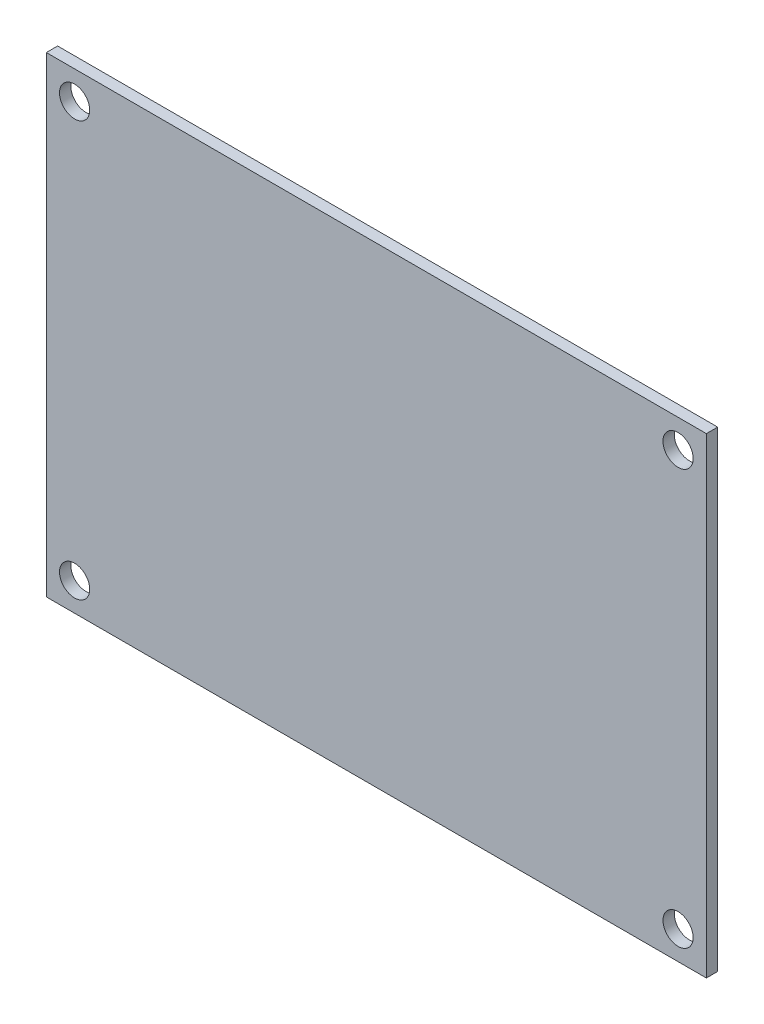
from build123d import *

# Parameters (mm, degrees)
SKETCH1_W           = 70
SKETCH1_H           = 50
BOSS_EXTRUDE1_DEPTH = 1.2
CUT_EXTRUDE1_REACH  = 45.028
SKETCH6_R           = 1.6


with BuildPart() as part:
    # Sketch1 → Boss-Extrude1 (new body)
    with BuildSketch(Plane.XY):
        Rectangle(SKETCH1_W, SKETCH1_H)
    extrude(amount=BOSS_EXTRUDE1_DEPTH)

    # Sketch6 → Cut-Extrude1 (cut, up to next)
    with BuildSketch(Plane.XY.offset(1.2), mode=Mode.PRIVATE) as cut_extrude1_sk1:
        with Locations((-32, -22)):
            Circle(SKETCH6_R)
    cut_extrude1_tool1 = extrude(cut_extrude1_sk1.sketch, amount=-CUT_EXTRUDE1_REACH, mode=Mode.PRIVATE) & part.part
    # Sketch6 → Cut-Extrude1 (cut, up to next)
    with BuildSketch(Plane.XY.offset(1.2), mode=Mode.PRIVATE) as cut_extrude1_sk2:
        with Locations(Location((32, -22, 0), (0, 0, 180))):
            Circle(SKETCH6_R)
    cut_extrude1_tool2 = extrude(cut_extrude1_sk2.sketch, amount=-CUT_EXTRUDE1_REACH, mode=Mode.PRIVATE) & part.part
    # Sketch6 → Cut-Extrude1 (cut, up to next)
    with BuildSketch(Plane.XY.offset(1.2), mode=Mode.PRIVATE) as cut_extrude1_sk3:
        with Locations((32, 22)):
            Circle(SKETCH6_R)
    cut_extrude1_tool3 = extrude(cut_extrude1_sk3.sketch, amount=-CUT_EXTRUDE1_REACH, mode=Mode.PRIVATE) & part.part
    # Sketch6 → Cut-Extrude1 (cut, up to next)
    with BuildSketch(Plane.XY.offset(1.2), mode=Mode.PRIVATE) as cut_extrude1_sk4:
        with Locations(Location((-32, 22, 0), (0, 0, 180))):
            Circle(SKETCH6_R)
    cut_extrude1_tool4 = extrude(cut_extrude1_sk4.sketch, amount=-CUT_EXTRUDE1_REACH, mode=Mode.PRIVATE) & part.part
    add(cut_extrude1_tool1.solids().sort_by_distance((-32, -22, 1.2))[0], mode=Mode.SUBTRACT)
    add(cut_extrude1_tool2.solids().sort_by_distance((32, -22, 1.2))[0], mode=Mode.SUBTRACT)
    add(cut_extrude1_tool3.solids().sort_by_distance((32, 22, 1.2))[0], mode=Mode.SUBTRACT)
    add(cut_extrude1_tool4.solids().sort_by_distance((-32, 22, 1.2))[0], mode=Mode.SUBTRACT)


solid = part.part
